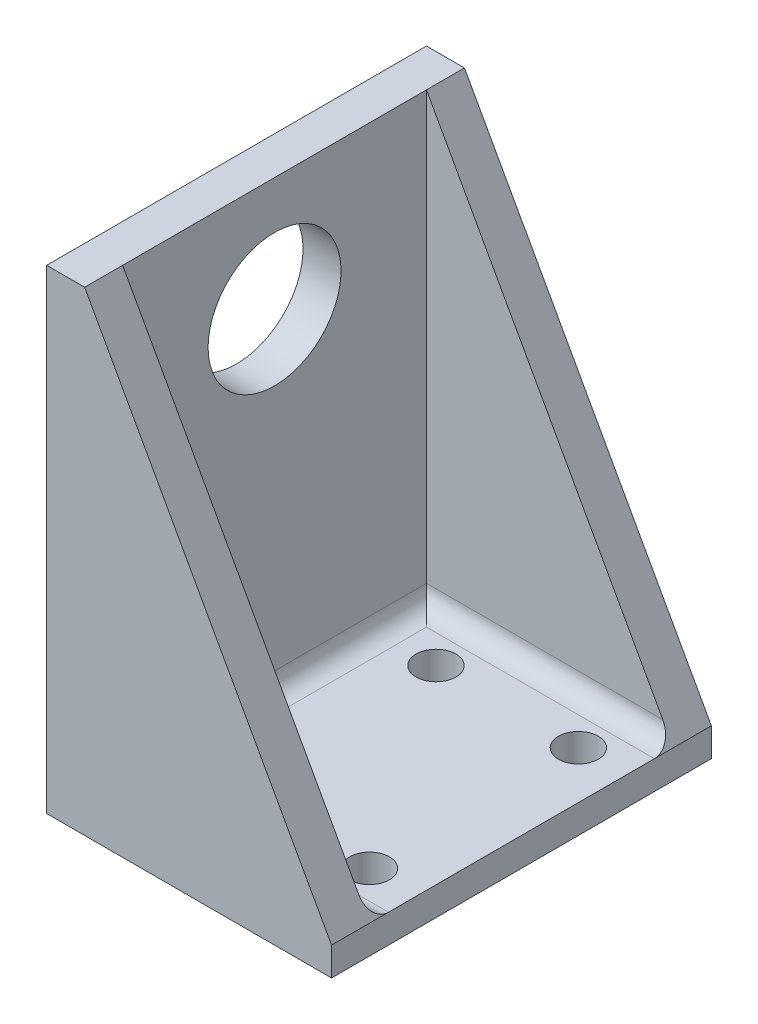
from build123d import *

# Parameters (mm, degrees)
SSS_W               = 30
SSS_H               = 40
SSS_R               = 2.1
BOSS_EXTRUDE2_DEPTH = 3
SKETCH1_W           = 40
SKETCH1_H           = 50
SKETCH1_R           = 7
BOSS_EXTRUDE3_DEPTH = 4
BOSS_EXTRUDE4_DEPTH = 4
FILLET1_R           = 2


with BuildPart() as part:
    # sss → Boss-Extrude2 (new body)
    with BuildSketch(Plane(origin=(0, 0, 0), x_dir=(1, 0, 0), z_dir=(0, 1, 0))):
        with Locations((5, 0)):
            Rectangle(SSS_W, SSS_H)
        with Locations(Location((0, 11, 0), (0, 0, 270))):
            Circle(SSS_R, mode=Mode.SUBTRACT)
        with Locations(Location((0, -11, 0), (0, 0, 90))):
            Circle(SSS_R, mode=Mode.SUBTRACT)
        with Locations(Location((15, -11, 0), (0, 0, 270))):
            Circle(SSS_R, mode=Mode.SUBTRACT)
        with Locations(Location((15, 11, 0), (0, 0, 90))):
            Circle(SSS_R, mode=Mode.SUBTRACT)
    extrude(amount=BOSS_EXTRUDE2_DEPTH)

    # Sketch1 → Boss-Extrude3 (add)
    with BuildSketch(Plane.ZY.offset(10)):
        with Locations((0, 25)):
            Rectangle(SKETCH1_W, SKETCH1_H)
        with Locations((0, 38)):
            Circle(SKETCH1_R, mode=Mode.SUBTRACT)
    extrude(amount=-BOSS_EXTRUDE3_DEPTH)

    # Sketch2 → Boss-Extrude4 (add)
    with BuildSketch(Plane.XY.offset(20)):
        Polygon((-10, 50), (-10, 0), (20, 0), (20, 3), (-6, 50), align=None)
    boss_extrude4 = extrude(amount=-BOSS_EXTRUDE4_DEPTH)

    # Mirror1: Boss-Extrude4 across plane
    add(boss_extrude4.mirror(Plane.XY))

    # Fillet1
    fillet1_edges = [part.edges().sort_by_distance(p)[0] for p in [
        (7, 3, 16),
        (-6, 3, 0),
        (7, 3, -16),
    ]]
    fillet(fillet1_edges, radius=FILLET1_R)


solid = part.part
